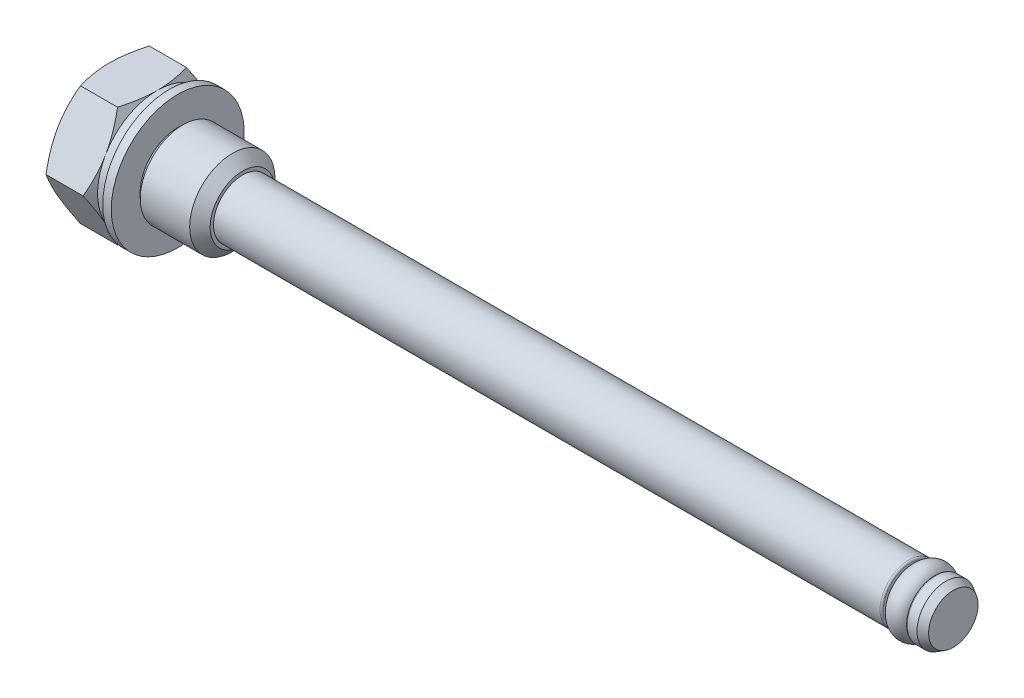
from build123d import *

# Parameters (mm, degrees)
SKETCH2_W          = 20
SKETCH2_H          = 20
CUT_EXTRUDE1_DEPTH = 5
SKETCH4_W          = 0.5
SKETCH4_H          = 1.75


with BuildPart() as part:
    # Sketch1 → Revolve1 (revolve)
    with BuildSketch(Plane.XY, mode=Mode.PRIVATE) as revolve1_sk:
        with BuildLine():
            Line((-3.5, 0), (-3.5, 3.5))
            Line((-3.5, 3.5), (-2.1, 5.924871131))
            Line((-2.1, 5.924871131), (-0.7, 3.5))
            Line((-0.7, 3.5), (0, 3.5))
            Line((0, 3.5), (0, 2.5))
            Line((0, 2.5), (0.258578644, 2.241421356))
            ThreePointArc((0.258578644, 2.241421356), (0.4, 2.182842712), (0.541421356, 2.241421356))
            Line((0.541421356, 2.241421356), (0.8, 2.5))
            Line((0.8, 2.5), (3.7, 2.5))
            Line((3.7, 2.5), (4.3, 1.9))
            Line((4.3, 1.9), (4.3, 1.7))
            Line((4.3, 1.7), (43.4, 1.7))
            ThreePointArc((43.4, 1.7), (43.470710678, 1.670710678), (43.5, 1.6))
            Line((43.5, 1.6), (43.5, 1.3))
            ThreePointArc((43.5, 1.3), (43.529289322, 1.229289322), (43.6, 1.2))
            Line((43.6, 1.2), (44.8, 1.2))
            ThreePointArc((44.8, 1.2), (44.870710678, 1.229289322), (44.9, 1.3))
            Line((44.9, 1.3), (44.9, 1.6))
            ThreePointArc((44.9, 1.6), (44.929289322, 1.670710678), (45, 1.7))
            Line((45, 1.7), (45.566987298, 1.7))
            Line((45.566987298, 1.7), (46, 1.45))
            Line((46, 1.45), (46, 0))
            Line((46, 0), (-3.5, 0))
        make_face()
    revolve(revolve1_sk.sketch.rotate(Axis((46, 0, 0), (-1, 0, 0)), 270), axis=Axis((46, 0, 0), (-1, 0, 0)))

    # Sketch2 → Cut-Extrude1 (cut)
    with BuildSketch(Plane.ZY.offset(3.5)):
        Rectangle(SKETCH2_W, SKETCH2_H)
        Polygon((2.020725942, -3.5), (4.041451884, 0), (2.020725942, 3.5), (-2.020725942, 3.5), (-4.041451884, 0), (-2.020725942, -3.5), align=None, mode=Mode.SUBTRACT)
    extrude(amount=-CUT_EXTRUDE1_DEPTH, mode=Mode.SUBTRACT)

    # Sketch3 → Revolve2 (revolve)
    with BuildSketch(Plane.XY, mode=Mode.PRIVATE) as revolve2_sk:
        with BuildLine():
            Line((43.5, 1.2), (44.9, 1.2))
            ThreePointArc((44.9, 1.2), (44.2, 1.9), (43.5, 1.2))
        make_face()
    revolve(revolve2_sk.sketch.rotate(Axis((44.9, 0, 0), (-1, 0, 0)), 270), axis=Axis((44.9, 0, 0), (-1, 0, 0)))

    # Sketch4 → Revolve3 (revolve)
    with BuildSketch(Plane.XY, mode=Mode.PRIVATE) as revolve3_sk:
        with Locations((0.25, 3.025)):
            Rectangle(SKETCH4_W, SKETCH4_H)
    revolve(revolve3_sk.sketch.rotate(Axis((0.5, 0, 0), (-1, 0, 0)), 270), axis=Axis((0.5, 0, 0), (-1, 0, 0)))


solid = part.part
